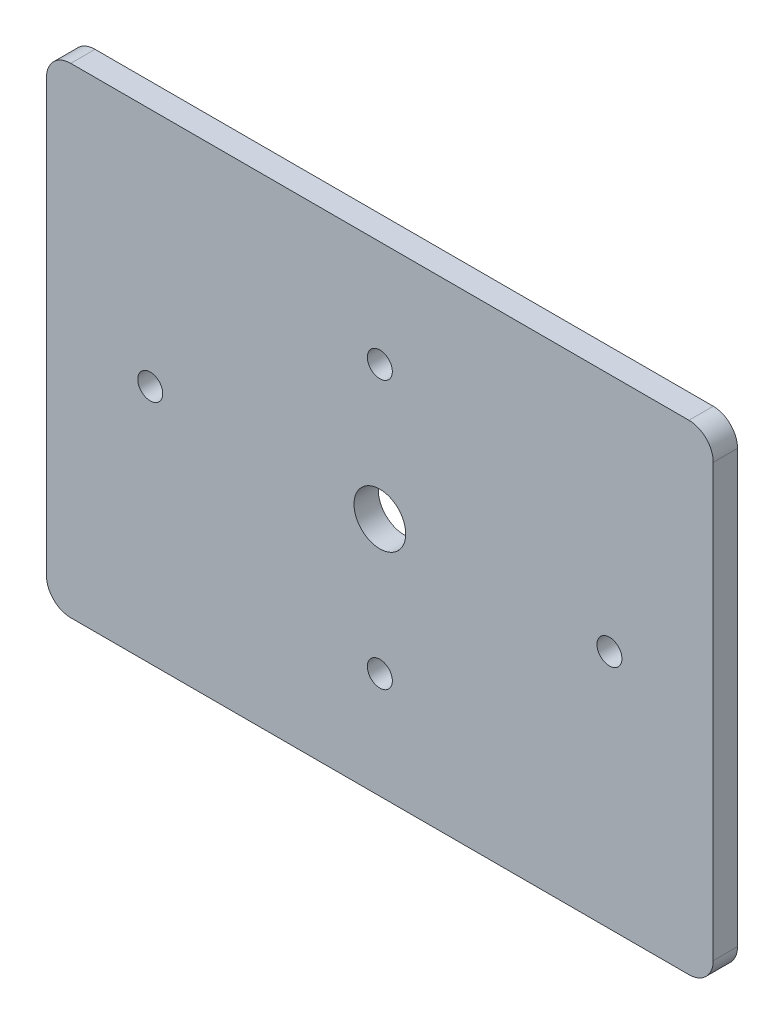
from build123d import *

# Parameters (mm, degrees)
SKETCH1_W               = 87.122
SKETCH1_H               = 62.738
BOSS_EXTRUDE1_DEPTH     = 3.175
F_4_CLEARANCE_HOLE1_D   = 3.2639
F_1_4_CLEARANCE_HOLE1_D = 6.7564
FILLET1_R               = 3.175


with BuildPart() as part:
    # Sketch1 → Boss-Extrude1 (new body)
    with BuildSketch(Plane.XY):
        with Locations((43.561, 31.369)):
            Rectangle(SKETCH1_W, SKETCH1_H)
    extrude(amount=BOSS_EXTRUDE1_DEPTH)

    # #4 Clearance Hole1 (through all)
    with Locations(Plane.XY.offset(3.175)):
        with Locations((43.561, 13.869), (73.561, 31.369), (13.561, 31.369), (43.561, 48.869)):
            Hole(F_4_CLEARANCE_HOLE1_D / 2)

    # 1/4 Clearance Hole1 (through all)
    with Locations(Plane.XY.offset(3.175)):
        with Locations((43.561, 31.369)):
            Hole(F_1_4_CLEARANCE_HOLE1_D / 2)

    # Fillet1
    fillet1_edges = [part.edges().sort_by_distance(p)[0] for p in [
        (0, 62.738, 1.5875),
        (87.122, 62.738, 1.5875),
        (87.122, 0, 1.5875),
        (0, 0, 1.5875),
    ]]
    fillet(fillet1_edges, radius=FILLET1_R)


solid = part.part
